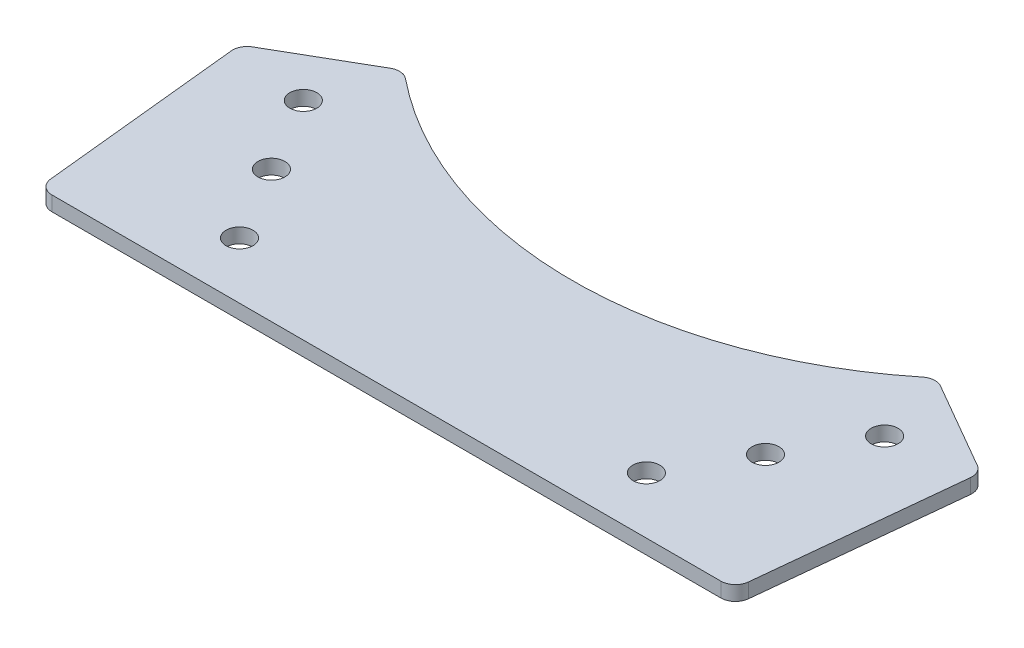
from build123d import *

# Parameters (mm, degrees)
SKETCH1_W             = 76.2
SKETCH1_H             = 19.05
BOSS_EXTRUDE1_DEPTH   = 1.6
BOSS_EXTRUDE2_DEPTH   = 1.6
BOSS_EXTRUDE3_DEPTH   = 1.6
BOSS_EXTRUDE4_DEPTH   = 1.6
BOSS_EXTRUDE5_DEPTH   = 1.6
FILLET4_R             = 1.5875
F_4_CLEARANCE_HOLE1_D = 2.9464


with BuildPart() as part:
    # Sketch1 → Boss-Extrude1 (new body)
    with BuildSketch(Plane(origin=(0, 0, 0), x_dir=(1, 0, 0), z_dir=(0, 1, 0))):
        Rectangle(SKETCH1_W, SKETCH1_H)
    extrude(amount=BOSS_EXTRUDE1_DEPTH)

    # Sketch2 → Boss-Extrude2 (add)
    with BuildSketch(Plane.XZ):
        Polygon((-40.48125, -13.649445986), (-29.089234633, -20.226629124), (-22.910646178, -9.525), (-34.302661544, -2.947816861), align=None)
    boss_extrude2 = extrude(amount=-BOSS_EXTRUDE2_DEPTH)

    # Sketch3 → Boss-Extrude3 (add)
    with BuildSketch(Plane.XZ):
        Polygon((-38.1, 9.525), (-40.48125, -13.649445986), (-22.910646178, -9.525), align=None)
    boss_extrude3 = extrude(amount=-BOSS_EXTRUDE3_DEPTH)

    # Mirror1: Boss-Extrude2, Boss-Extrude3 across plane
    add(boss_extrude2.mirror(Plane(origin=(0, 0, 0), x_dir=(0, 0, 1), z_dir=(1, 0, 0))))
    add(boss_extrude3.mirror(Plane(origin=(0, 0, 0), x_dir=(0, 0, 1), z_dir=(1, 0, 0))))

    # Sketch4 → Boss-Extrude4 (add)
    with BuildSketch(Plane.XZ):
        with BuildLine():
            Line((-29.089234633, -20.226629124), (-29.089234633, 9.525))
            Line((-29.089234633, 9.525), (29.089234633, 9.525))
            Line((29.089234633, 9.525), (29.089234633, -20.226629124))
            ThreePointArc((29.089234633, -20.226629124), (0, -9.525), (-29.089234633, -20.226629124))
        make_face()
    extrude(amount=-BOSS_EXTRUDE4_DEPTH)

    # Sketch5 → Boss-Extrude5 (add)
    with BuildSketch(Plane.XZ):
        Polygon((-38.1, 9.525), (-37.969503353, 10.795), (37.969503353, 10.795), (38.1, 9.525), align=None)
    extrude(amount=-BOSS_EXTRUDE5_DEPTH)

    # Fillet4
    fillet4_edges = [part.edges().sort_by_distance(p)[0] for p in [
        (-40.48125, 0.8, -13.649445986),
        (-29.089234633, 0.8, -20.226629124),
        (40.48125, 0.8, -13.649445986),
        (29.089234633, 0.8, -20.226629124),
        (37.969503353, 0.8, 10.795),
        (-37.969503353, 0.8, 10.795),
    ]]
    fillet(fillet4_edges, radius=FILLET4_R)

    # #4 Clearance Hole1 (through all)
    with Locations(Plane(origin=(-22.225, 0, 4.621670802), x_dir=(0, 0, -1), z_dir=(0, -1, 0))):
        with Locations((0, 0), (8.248891971, -4.7625), (16.497783942, -9.525)):
            f_4_clearance_hole1 = Hole(F_4_CLEARANCE_HOLE1_D / 2)

    # Mirror2: #4 Clearance Hole1 across plane
    add(f_4_clearance_hole1.mirror(Plane(origin=(0, 0, 0), x_dir=(0, 0, 1), z_dir=(1, 0, 0))), mode=Mode.SUBTRACT)


solid = part.part
